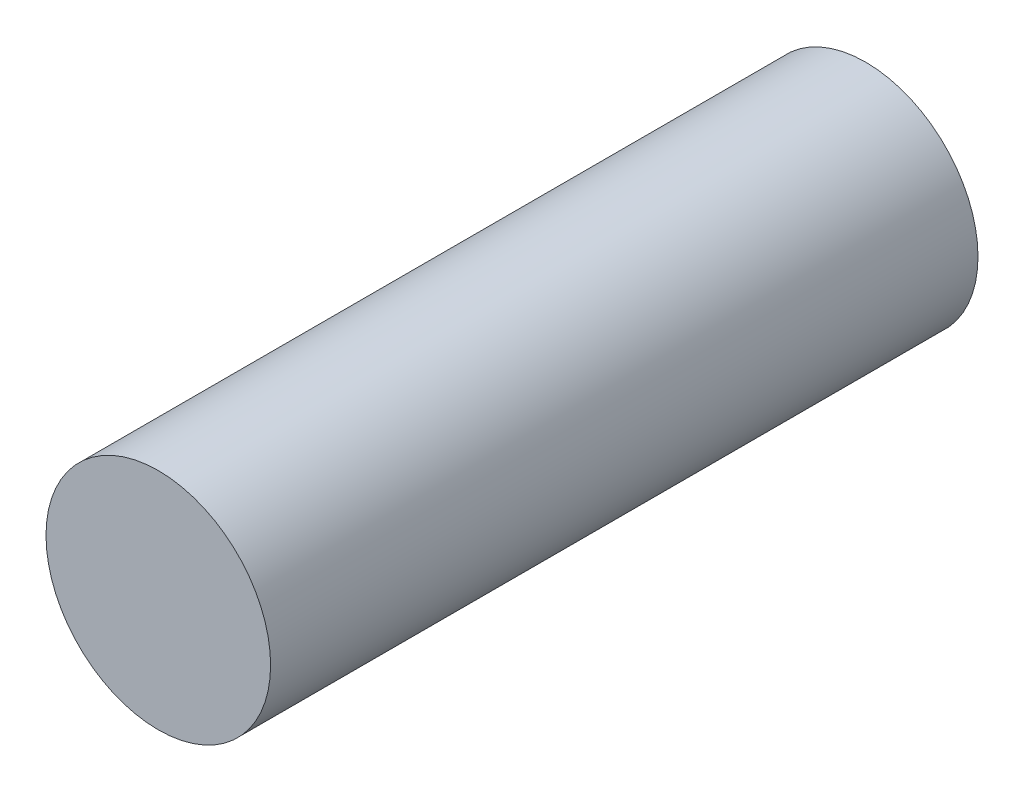
from build123d import *

# Parameters (mm, degrees)
BOSS_EXTRUDE1_DEPTH = 20


with BuildPart() as part:
    # Sketch1 → Boss-Extrude1 (new, symmetric)
    with BuildSketch(Plane.XY):
        with BuildLine():
            ThreePointArc((6.35, 0), (5.499261326, 3.174999979), (3.175000041, 5.49926129))
            ThreePointArc((3.175000041, 5.49926129), (6.4e-08, 6.35), (-3.174999931, 5.499261354))
            ThreePointArc((-3.174999931, 5.499261354), (-5.499261299, 3.175000026), (-6.35, -1.9e-08))
            ThreePointArc((-6.35, -1.9e-08), (-5.499261291, -3.17500004), (-3.174999936, -5.499261351))
            ThreePointArc((-3.174999936, -5.499261351), (8e-09, -6.35), (3.17499995, -5.499261343))
            ThreePointArc((3.17499995, -5.499261343), (5.4992613, -3.175000025), (6.35, 0))
        make_face()
    extrude(amount=BOSS_EXTRUDE1_DEPTH, both=True)


solid = part.part
